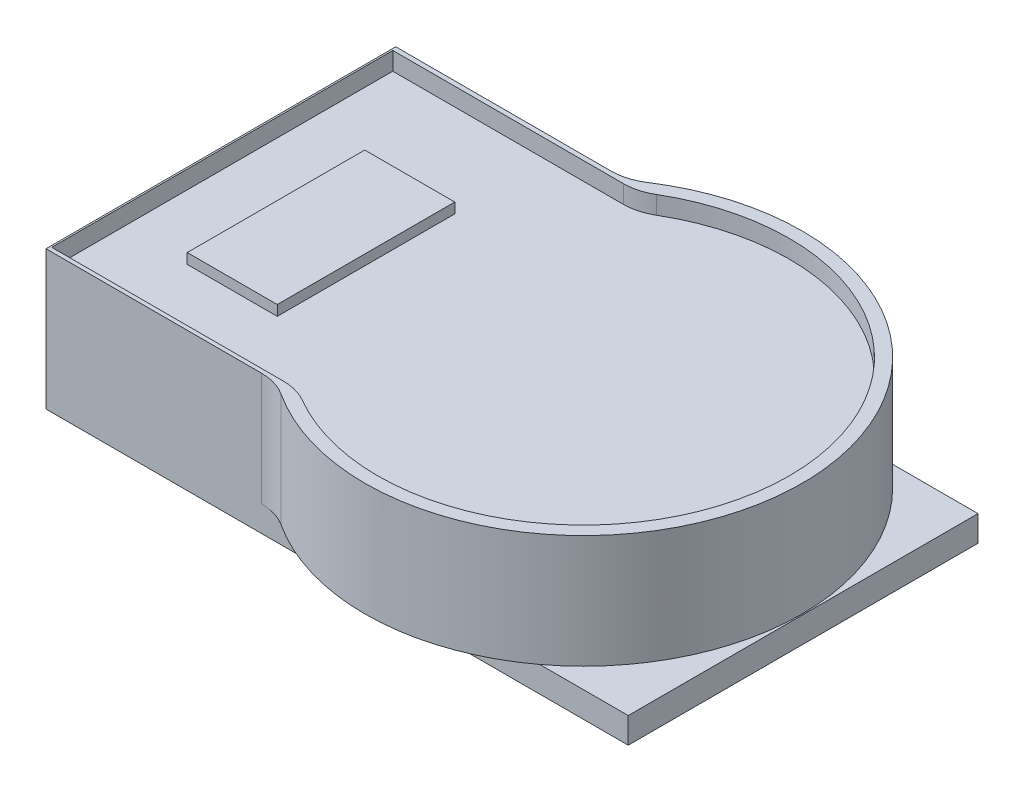
from build123d import *

# Parameters (mm, degrees)
BOSS_EXTRUDE1_DEPTH = 22
FILLET1_R           = 10
CUT_EXTRUDE1_DEPTH  = 3.5
FILLET2_R           = 10
SKETCH4_W           = 17.500655667
SKETCH4_H           = 34.508335117
BOSS_EXTRUDE2_DEPTH = 2
SKETCH5_W           = 113.192264834
SKETCH5_H           = 68
BOSS_EXTRUDE3_DEPTH = 5


with BuildPart() as part:
    # Sketch1 → Boss-Extrude1 (new body)
    with BuildSketch(Plane(origin=(0, 0, 0), x_dir=(1, 0, 0), z_dir=(0, 1, 0))):
        with BuildLine():
            Line((-70.5, 34), (-25.5, 34))
            ThreePointArc((-25.5, 34), (42.5, 0), (-25.5, -34))
            Line((-25.5, -34), (-70.5, -34))
            Line((-70.5, -34), (-70.5, 34))
        make_face()
    extrude(amount=BOSS_EXTRUDE1_DEPTH)

    # Fillet1
    fillet1_edges = [part.edges().sort_by_distance(p)[0] for p in [
        (-25.5, 11, -34),
        (-25.5, 11, 34),
    ]]
    fillet(fillet1_edges, radius=FILLET1_R)

    # Sketch3 → Cut-Extrude1 (cut)
    with BuildSketch(Plane(origin=(0, 22, 0), x_dir=(1, 0, 0), z_dir=(0, 1, 0))):
        with BuildLine():
            Line((-22.471845342, 33.091028496), (-70.175642943, 33.091028496))
            Line((-70.175642943, 33.091028496), (-70.175642943, -33.21427255))
            Line((-70.175642943, -33.21427255), (-22.289282155, -33.21427255))
            ThreePointArc((-22.289282155, -33.21427255), (39.99984838, 0.110134479), (-22.471845342, 33.091028496))
        make_face()
    extrude(amount=-CUT_EXTRUDE1_DEPTH, mode=Mode.SUBTRACT)

    # Fillet2
    fillet2_edges = [part.edges().sort_by_distance(p)[0] for p in [
        (-22.471845342, 20.25, -33.091028496),
        (-22.289282155, 20.25, 33.21427255),
    ]]
    fillet(fillet2_edges, radius=FILLET2_R)

    # Sketch4 → Boss-Extrude2 (add)
    with BuildSketch(Plane(origin=(0, 18.5, 0), x_dir=(1, 0, 0), z_dir=(0, 1, 0))):
        with Locations((-48.878067279, -2.156770944)):
            Rectangle(SKETCH4_W, SKETCH4_H)
    extrude(amount=BOSS_EXTRUDE2_DEPTH)

    # Sketch5 → Boss-Extrude3 (add)
    with BuildSketch(Plane.XZ):
        with Locations((-13.903867583, 0)):
            Rectangle(SKETCH5_W, SKETCH5_H)
    extrude(amount=BOSS_EXTRUDE3_DEPTH)


solid = part.part
